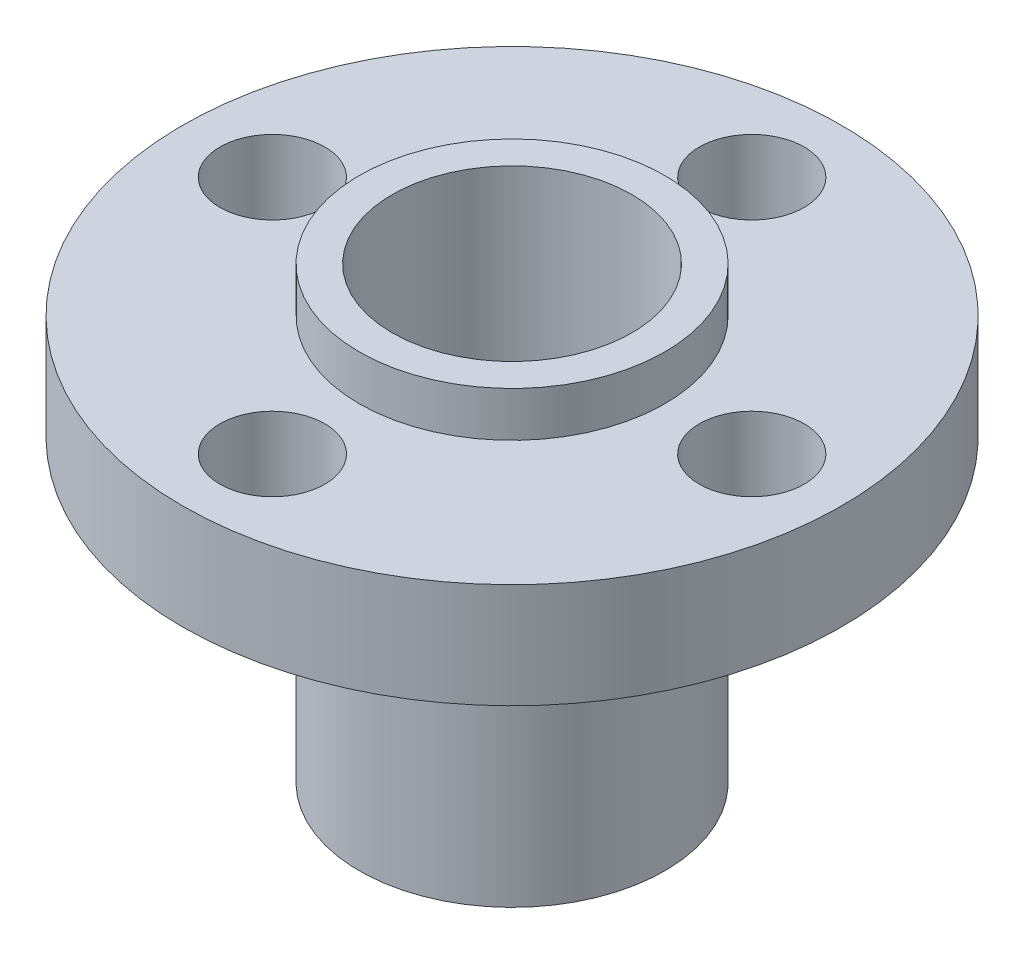
from build123d import *

# Parameters (mm, degrees)
SKETCH_1_R      = 11
EXTRUDE_1_DEPTH = 3.5
SKETCH_2_R      = 5.1
EXTRUDE_2_DEPTH = 1.5
EXTRUDE_START   = 10
SKETCH_3_R      = 5.1
EXTRUDE_3_DEPTH = 10
HOLE_WIZARD_1_D = 8
HOLE_WIZARD_2_D = 3.5


with BuildPart() as part:
    # 草图1 → 凸台-拉伸1 (new body)
    with BuildSketch(Plane(origin=(0, 0, 0), x_dir=(1, 0, 0), z_dir=(0, 1, 0))):
        with Locations(Location((0, 0, 0), (0, 0, 270))):
            Circle(SKETCH_1_R)
    extrude(amount=EXTRUDE_1_DEPTH)

    # 草图2 → 凸台-拉伸2 (add)
    with BuildSketch(Plane(origin=(0, 3.5, 0), x_dir=(1, 0, 0), z_dir=(0, 1, 0))):
        with Locations(Location((0, 0, 0), (0, 0, 270))):
            Circle(SKETCH_2_R)
    extrude(amount=EXTRUDE_2_DEPTH)

    # 草图3 → 凸台-拉伸3 (add)
    with BuildSketch(Plane.XZ.offset(EXTRUDE_START)):
        with Locations(Location((0, 0, 0), (0, 0, 90))):
            Circle(SKETCH_3_R)
    extrude(amount=-EXTRUDE_3_DEPTH)

    # 孔1 (through all)
    with Locations(Plane(origin=(0, 5, 0), x_dir=(1, 0, 0), z_dir=(0, 1, 0))):
        with Locations((0, 0)):
            Hole(HOLE_WIZARD_1_D / 2)

    # 孔2 (through all)
    with Locations(Plane(origin=(0, 3.5, 0), x_dir=(1, 0, 0), z_dir=(0, 1, 0))):
        with Locations((-8, 0), (0, 8), (8, 0), (0, -8)):
            Hole(HOLE_WIZARD_2_D / 2)


solid = part.part
